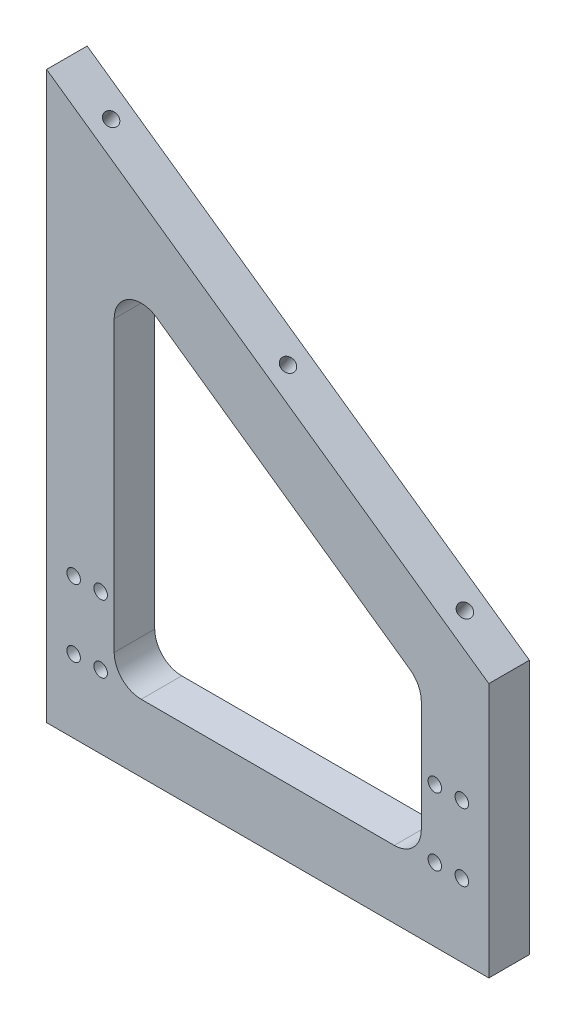
from build123d import *

# Parameters (mm, degrees)
EXTRUDE_1_DEPTH        = 15
CUT_EXTRUDE_1_DEPTH    = 267.118858915
FILLET_1_R             = 10
PATTERN_LINEAR_1_COUNT = 3
PATTERN_LINEAR_1_PITCH = 50
PATTERN_LINEAR_2_COUNT = 3
PATTERN_LINEAR_2_PITCH = 80
HOLE_WIZARD_M6_3_D     = 5


with BuildPart() as part:
    # 草图1 → 凸台-拉伸1 (new body)
    with BuildSketch(Plane.XY):
        Polygon((0, 0), (163.629943485, 0), (163.629943485, 94.33), (0, 209.331050409), align=None)
    extrude(amount=EXTRUDE_1_DEPTH)

    # 草图2 → 切除-拉伸1 (cut, through all)
    with BuildSketch(Plane.XY.offset(15)):
        Polygon((25, 161.2040017), (25, 25), (138.629943485, 25), (138.629943485, 81.343539854), align=None)
    extrude(amount=-CUT_EXTRUDE_1_DEPTH, mode=Mode.SUBTRACT)

    # 圆角1
    fillet_1_edges = [part.edges().sort_by_distance(p)[0] for p in [
        (25, 161.2040017, 7.5),
        (138.629943485, 81.343539854, 7.5),
        (138.629943485, 25, 7.5),
        (25, 25, 7.5),
    ]]
    fillet(fillet_1_edges, radius=FILLET_1_R)

    # 草图3 → M6 螺纹孔1 (revolve, cut)
    with BuildSketch(Plane(origin=(30, 0, 7.5), x_dir=(0, 0, -1), z_dir=(1, 0, 0))):
        Polygon((0, 0), (0, 16.502151548), (2.5, 15), (2.5, 0), align=None)
    hole_wizard_m6_1 = revolve(axis=Axis((30, -6.35, 7.5), (0, 1, 0)), mode=Mode.SUBTRACT)

    # 阵列(线性)1: M6 螺纹孔1 ×3
    with Locations(*[(i * PATTERN_LINEAR_1_PITCH, 0, 0) for i in range(1, PATTERN_LINEAR_1_COUNT)]):
        add(hole_wizard_m6_1, mode=Mode.SUBTRACT)

    # 草图5 → M6 螺纹孔2 (revolve, cut)
    with BuildSketch(Plane(origin=(147.266949137, 105.830105041, 7.5), x_dir=(-0.8181497174250246, 0.5750052520432769, 0), z_dir=(0, 0, 1))):
        Polygon((0, 0), (0, 16.502151548), (2.5, 15), (2.5, 0), align=None)
    hole_wizard_m6_2 = revolve(axis=Axis((150.918232487, 111.025355747, 7.5), (-0.5750052520432769, -0.8181497174250246, 0)), mode=Mode.SUBTRACT)

    # 阵列(线性)2: M6 螺纹孔2 ×3
    with Locations(*[Vector(-0.8181497174250245, 0.575005252043277, 0) * (i * PATTERN_LINEAR_2_PITCH) for i in range(1, PATTERN_LINEAR_2_COUNT)]):
        add(hole_wizard_m6_2, mode=Mode.SUBTRACT)

    # M6 螺纹孔3 (through all)
    with Locations(Plane.XY.offset(15)):
        with Locations((20, 27), (20, 52), (10, 52), (10, 27), (143.629943485, 52), (153.629943485, 52), (143.629943485, 27), (153.629943485, 27)):
            Hole(HOLE_WIZARD_M6_3_D / 2)


solid = part.part
